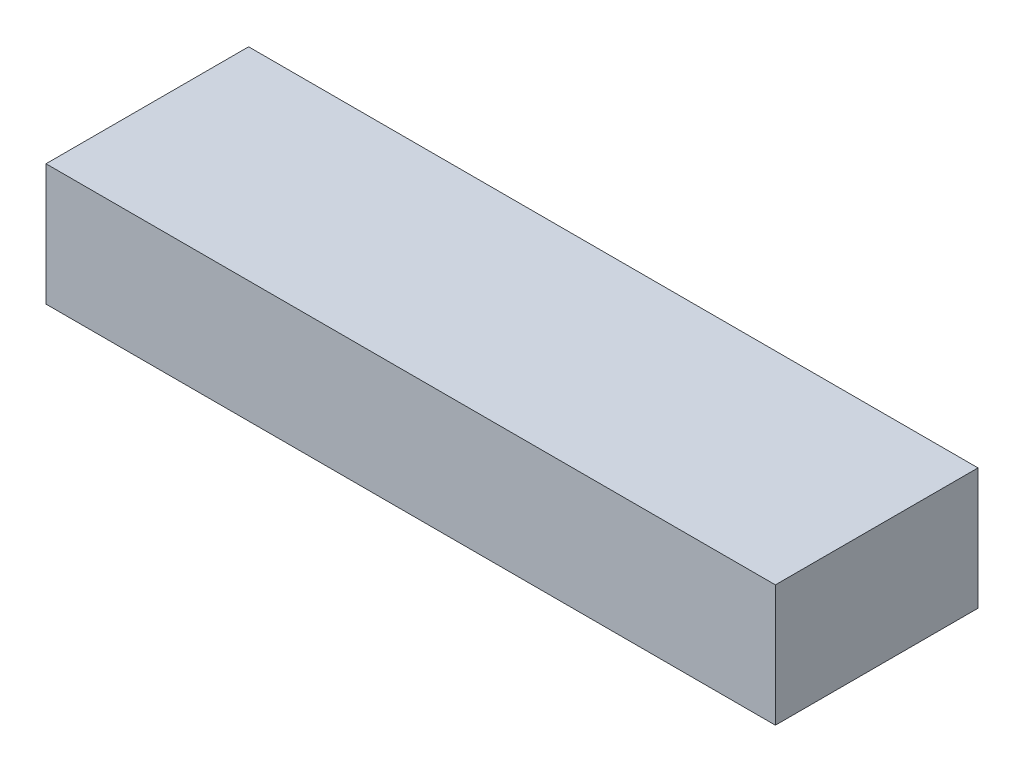
from build123d import *

# Parameters (mm, degrees)
SKETCH1_W           = 180
SKETCH1_H           = 50
BOSS_EXTRUDE1_DEPTH = 30


with BuildPart() as part:
    # Sketch1 → Boss-Extrude1 (new body)
    with BuildSketch(Plane(origin=(0, 0, 0), x_dir=(1, 0, 0), z_dir=(0, 1, 0))):
        Rectangle(SKETCH1_W, SKETCH1_H)
    extrude(amount=BOSS_EXTRUDE1_DEPTH)


solid = part.part
